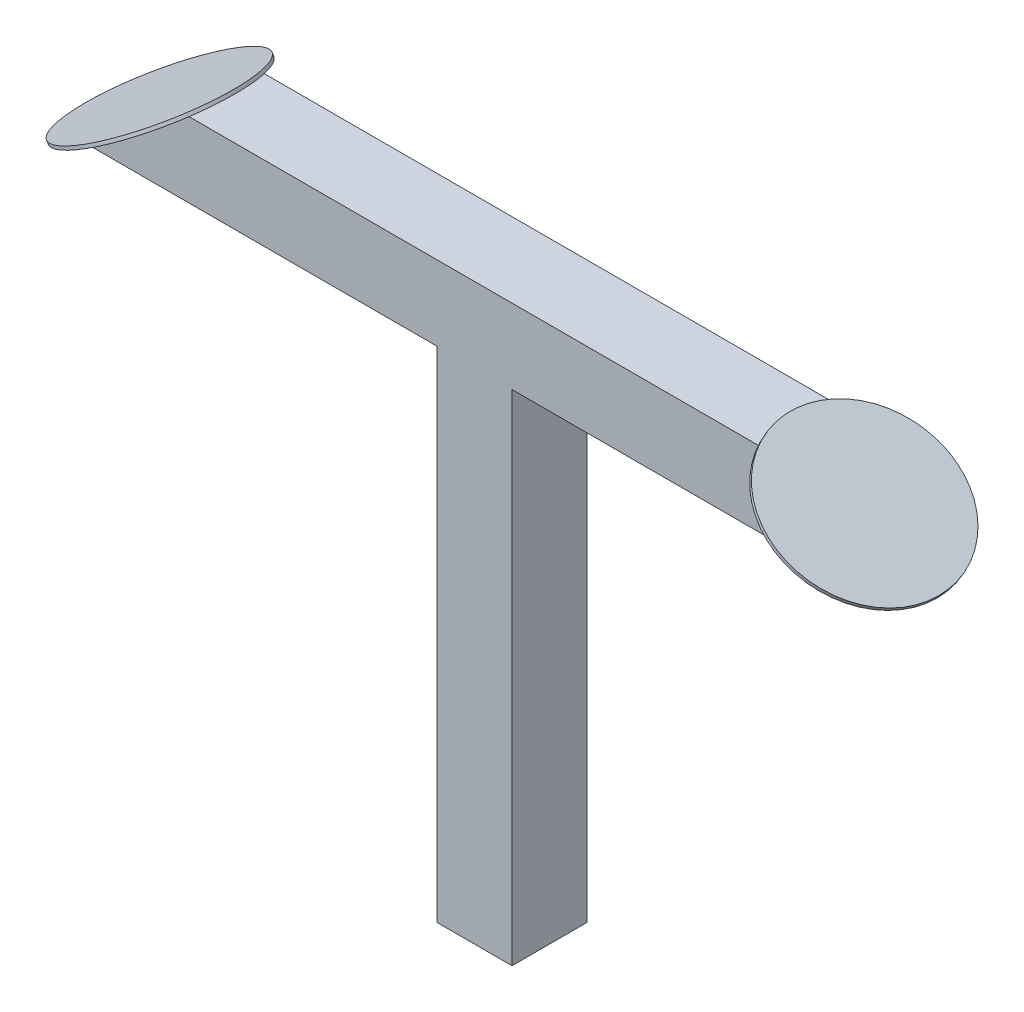
from build123d import *

# Parameters (mm, degrees)
SKETCH1_W           = 45
SKETCH1_H           = 45
BOSS_EXTRUDE1_DEPTH = 300
SKETCH2_W           = 500
SKETCH2_H           = 45
BOSS_EXTRUDE2_DEPTH = 45
SHELL2_T            = -5
CUT_EXTRUDE1_DEPTH  = 45
SKETCH5_R           = 51.5
BOSS_EXTRUDE3_DEPTH = 2


with BuildPart() as part:
    # Sketch1 → Boss-Extrude1 (new body)
    with BuildSketch(Plane(origin=(0, 0, 0), x_dir=(1, 0, 0), z_dir=(0, 1, 0))):
        Rectangle(SKETCH1_W, SKETCH1_H)
    extrude(amount=BOSS_EXTRUDE1_DEPTH)

    # Sketch2 → Boss-Extrude2 (add)
    with BuildSketch(Plane(origin=(0, 300, 0), x_dir=(1, 0, 0), z_dir=(0, 1, 0))):
        Rectangle(SKETCH2_W, SKETCH2_H)
    extrude(amount=BOSS_EXTRUDE2_DEPTH)

    # Shell2
    shell2_openings = [part.faces().sort_by_distance(p)[0] for p in [
        (250, 322.5, 0),
        (-250, 322.5, 0),
        (0, 0, 0),
    ]]
    offset(amount=SHELL2_T, openings=shell2_openings, kind=Kind.INTERSECTION)

    # Sketch4 → Cut-Extrude1 (cut)
    with BuildSketch(Plane.XY.offset(22.5)):
        Polygon((-250, 300), (-172.057713659, 345), (-187.263807884, 591.817806189), (-292.402197695, 585.340379431), (-265.544239109, 495.362755895), align=None)
    cut_extrude1 = extrude(amount=-CUT_EXTRUDE1_DEPTH, mode=Mode.SUBTRACT)

    # Sketch5 → Boss-Extrude3 (add)
    with BuildSketch(Plane(origin=(-192.403810568, 333.253175473, 0), x_dir=(0.8660254037844376, 0.500000000000002, 0), z_dir=(-0.5000000000000019, 0.8660254037844375, 0))):
        with Locations(Location((-21.506350946, 0, 0), (0, 0, 180))):
            Circle(SKETCH5_R)
    boss_extrude3 = extrude(amount=BOSS_EXTRUDE3_DEPTH)

    # Mirror1: Cut-Extrude1, Boss-Extrude3 across plane
    add(cut_extrude1.mirror(Plane(origin=(0, 0, 0), x_dir=(0, 0, 1), z_dir=(1, 0, 0))), mode=Mode.SUBTRACT)
    add(boss_extrude3.mirror(Plane(origin=(0, 0, 0), x_dir=(0, 0, 1), z_dir=(1, 0, 0))))


solid = part.part
